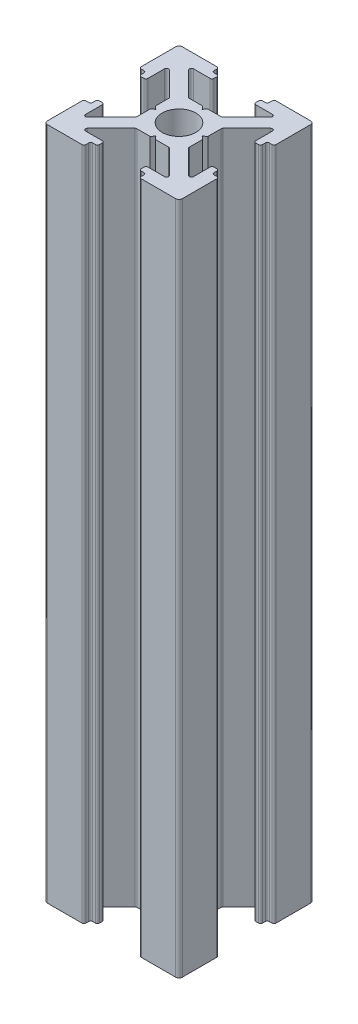
from build123d import *

# Parameters (mm, degrees)
SKETCH2_R                 = 2.5
VUONG_NHOMDH20X20_1_DEPTH = 100


with BuildPart() as part:
    # Sketch2 → Vuong NHOMDH20X20(1) (new body)
    with BuildSketch(Plane.ZX):
        with BuildLine():
            Line((0.385672566, 3.9), (2.360735931, 3.9))
            ThreePointArc((2.360735931, 3.9), (2.475540961, 3.92283614), (2.572867966, 3.987867966))
            Line((2.572867966, 3.987867966), (6.072867966, 7.487867966))
            ThreePointArc((6.072867966, 7.487867966), (6.137899791, 7.81480503), (5.860735931, 8))
            Line((5.860735931, 8), (3.4, 8))
            ThreePointArc((3.4, 8), (3.187867966, 8.087867966), (3.1, 8.3))
            Line((3.1, 8.3), (3.1, 8.7))
            ThreePointArc((3.1, 8.7), (3.187867966, 8.912132034), (3.4, 9))
            Line((3.4, 9), (3.8, 9))
            ThreePointArc((3.8, 9), (4.012132034, 9.087867966), (4.1, 9.3))
            Line((4.1, 9.3), (4.1, 9.7))
            ThreePointArc((4.1, 9.7), (4.187867966, 9.912132034), (4.4, 10))
            Line((4.4, 10), (9.5, 10))
            ThreePointArc((9.5, 10), (9.853553391, 9.853553391), (10, 9.5))
            Line((10, 9.5), (10, 4.4))
            ThreePointArc((10, 4.4), (9.912132034, 4.187867966), (9.7, 4.1))
            Line((9.7, 4.1), (9.3, 4.1))
            ThreePointArc((9.3, 4.1), (9.087867966, 4.012132034), (9, 3.8))
            Line((9, 3.8), (9, 3.4))
            ThreePointArc((9, 3.4), (8.912132034, 3.187867966), (8.7, 3.1))
            Line((8.7, 3.1), (8.3, 3.1))
            ThreePointArc((8.3, 3.1), (8.087867966, 3.187867966), (8, 3.4))
            Line((8, 3.4), (8, 5.860735931))
            ThreePointArc((8, 5.860735931), (7.81480503, 6.137899791), (7.487867966, 6.072867966))
            Line((7.487867966, 6.072867966), (3.987867966, 2.572867966))
            ThreePointArc((3.987867966, 2.572867966), (3.92283614, 2.475540961), (3.9, 2.360735931))
            Line((3.9, 2.360735931), (3.9, 0.385672566))
            Line((3.9, 0.385672566), (3.440373334, 0))
            Line((3.440373334, 0), (3.9, -0.385672566))
            Line((3.9, -0.385672566), (3.9, -2.360735931))
            ThreePointArc((3.9, -2.360735931), (3.92283614, -2.475540961), (3.987867966, -2.572867966))
            Line((3.987867966, -2.572867966), (7.487867966, -6.072867966))
            ThreePointArc((7.487867966, -6.072867966), (7.81480503, -6.137899791), (8, -5.860735931))
            Line((8, -5.860735931), (8, -3.4))
            ThreePointArc((8, -3.4), (8.087867966, -3.187867966), (8.3, -3.1))
            Line((8.3, -3.1), (8.7, -3.1))
            ThreePointArc((8.7, -3.1), (8.912132034, -3.187867966), (9, -3.4))
            Line((9, -3.4), (9, -3.8))
            ThreePointArc((9, -3.8), (9.087867966, -4.012132034), (9.3, -4.1))
            Line((9.3, -4.1), (9.7, -4.1))
            ThreePointArc((9.7, -4.1), (9.912132034, -4.187867966), (10, -4.4))
            Line((10, -4.4), (10, -9.5))
            ThreePointArc((10, -9.5), (9.853553391, -9.853553391), (9.5, -10))
            Line((9.5, -10), (4.4, -10))
            ThreePointArc((4.4, -10), (4.187867966, -9.912132034), (4.1, -9.7))
            Line((4.1, -9.7), (4.1, -9.3))
            ThreePointArc((4.1, -9.3), (4.012132034, -9.087867966), (3.8, -9))
            Line((3.8, -9), (3.4, -9))
            ThreePointArc((3.4, -9), (3.187867966, -8.912132034), (3.1, -8.7))
            Line((3.1, -8.7), (3.1, -8.3))
            ThreePointArc((3.1, -8.3), (3.187867966, -8.087867966), (3.4, -8))
            Line((3.4, -8), (5.860735931, -8))
            ThreePointArc((5.860735931, -8), (6.137899791, -7.81480503), (6.072867966, -7.487867966))
            Line((6.072867966, -7.487867966), (2.572867966, -3.987867966))
            ThreePointArc((2.572867966, -3.987867966), (2.475540961, -3.92283614), (2.360735931, -3.9))
            Line((2.360735931, -3.9), (0.385672566, -3.9))
            Line((0.385672566, -3.9), (0, -3.440373334))
            Line((0, -3.440373334), (-0.385672566, -3.9))
            Line((-0.385672566, -3.9), (-2.360735931, -3.9))
            ThreePointArc((-2.360735931, -3.9), (-2.475540961, -3.92283614), (-2.572867966, -3.987867966))
            Line((-2.572867966, -3.987867966), (-6.072867966, -7.487867966))
            ThreePointArc((-6.072867966, -7.487867966), (-6.137899791, -7.81480503), (-5.860735931, -8))
            Line((-5.860735931, -8), (-3.4, -8))
            ThreePointArc((-3.4, -8), (-3.187867966, -8.087867966), (-3.1, -8.3))
            Line((-3.1, -8.3), (-3.1, -8.7))
            ThreePointArc((-3.1, -8.7), (-3.187867966, -8.912132034), (-3.4, -9))
            Line((-3.4, -9), (-3.8, -9))
            ThreePointArc((-3.8, -9), (-4.012132034, -9.087867966), (-4.1, -9.3))
            Line((-4.1, -9.3), (-4.1, -9.7))
            ThreePointArc((-4.1, -9.7), (-4.187867966, -9.912132034), (-4.4, -10))
            Line((-4.4, -10), (-9.5, -10))
            ThreePointArc((-9.5, -10), (-9.853553391, -9.853553391), (-10, -9.5))
            Line((-10, -9.5), (-10, -4.4))
            ThreePointArc((-10, -4.4), (-9.912132034, -4.187867966), (-9.7, -4.1))
            Line((-9.7, -4.1), (-9.3, -4.1))
            ThreePointArc((-9.3, -4.1), (-9.087867966, -4.012132034), (-9, -3.8))
            Line((-9, -3.8), (-9, -3.4))
            ThreePointArc((-9, -3.4), (-8.912132034, -3.187867966), (-8.7, -3.1))
            Line((-8.7, -3.1), (-8.3, -3.1))
            ThreePointArc((-8.3, -3.1), (-8.087867966, -3.187867966), (-8, -3.4))
            Line((-8, -3.4), (-8, -5.860735931))
            ThreePointArc((-8, -5.860735931), (-7.81480503, -6.137899791), (-7.487867966, -6.072867966))
            Line((-7.487867966, -6.072867966), (-3.987867966, -2.572867966))
            ThreePointArc((-3.987867966, -2.572867966), (-3.92283614, -2.475540961), (-3.9, -2.360735931))
            Line((-3.9, -2.360735931), (-3.9, -0.385672566))
            Line((-3.9, -0.385672566), (-3.440373334, 0))
            Line((-3.440373334, 0), (-3.9, 0.385672566))
            Line((-3.9, 0.385672566), (-3.9, 2.360735931))
            ThreePointArc((-3.9, 2.360735931), (-3.92283614, 2.475540961), (-3.987867966, 2.572867966))
            Line((-3.987867966, 2.572867966), (-7.487867966, 6.072867966))
            ThreePointArc((-7.487867966, 6.072867966), (-7.81480503, 6.137899791), (-8, 5.860735931))
            Line((-8, 5.860735931), (-8, 3.4))
            ThreePointArc((-8, 3.4), (-8.087867966, 3.187867966), (-8.3, 3.1))
            Line((-8.3, 3.1), (-8.7, 3.1))
            ThreePointArc((-8.7, 3.1), (-8.912132034, 3.187867966), (-9, 3.4))
            Line((-9, 3.4), (-9, 3.8))
            ThreePointArc((-9, 3.8), (-9.087867966, 4.012132034), (-9.3, 4.1))
            Line((-9.3, 4.1), (-9.7, 4.1))
            ThreePointArc((-9.7, 4.1), (-9.912132034, 4.187867966), (-10, 4.4))
            Line((-10, 4.4), (-10, 9.5))
            ThreePointArc((-10, 9.5), (-9.853553391, 9.853553391), (-9.5, 10))
            Line((-9.5, 10), (-4.4, 10))
            ThreePointArc((-4.4, 10), (-4.187867966, 9.912132034), (-4.1, 9.7))
            Line((-4.1, 9.7), (-4.1, 9.3))
            ThreePointArc((-4.1, 9.3), (-4.012132034, 9.087867966), (-3.8, 9))
            Line((-3.8, 9), (-3.4, 9))
            ThreePointArc((-3.4, 9), (-3.187867966, 8.912132034), (-3.1, 8.7))
            Line((-3.1, 8.7), (-3.1, 8.3))
            ThreePointArc((-3.1, 8.3), (-3.187867966, 8.087867966), (-3.4, 8))
            Line((-3.4, 8), (-5.860735931, 8))
            ThreePointArc((-5.860735931, 8), (-6.137899791, 7.81480503), (-6.072867966, 7.487867966))
            Line((-6.072867966, 7.487867966), (-2.572867966, 3.987867966))
            ThreePointArc((-2.572867966, 3.987867966), (-2.475540961, 3.92283614), (-2.360735931, 3.9))
            Line((-2.360735931, 3.9), (-0.385672566, 3.9))
            Line((-0.385672566, 3.9), (0, 3.440373334))
            Line((0, 3.440373334), (0.385672566, 3.9))
        make_face()
        Circle(SKETCH2_R, mode=Mode.SUBTRACT)
    extrude(amount=VUONG_NHOMDH20X20_1_DEPTH)


solid = part.part
